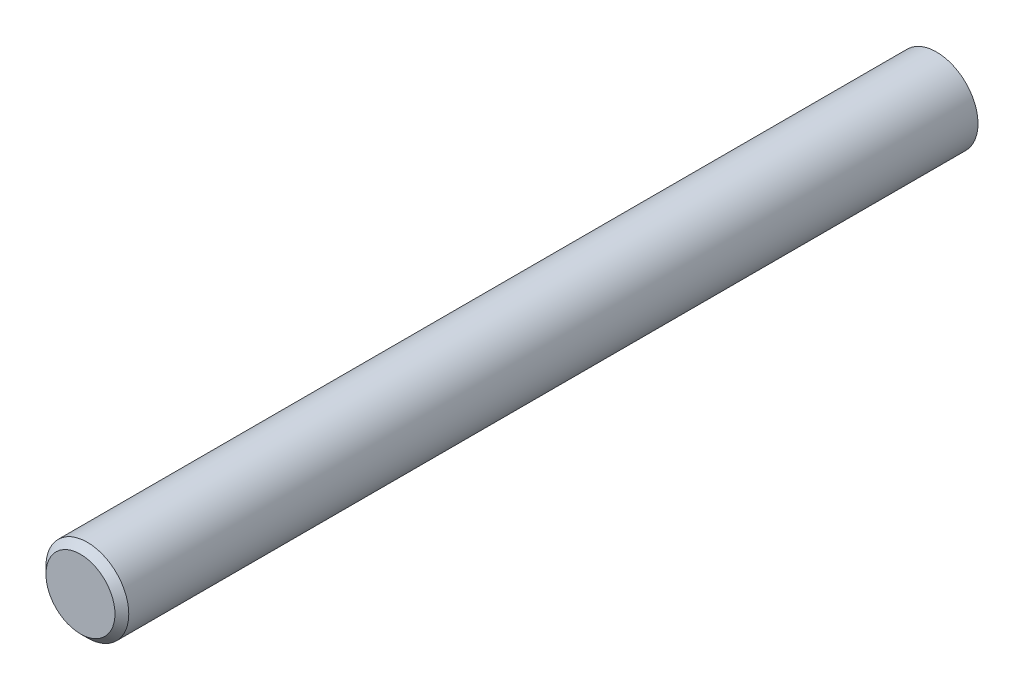
from build123d import *

# Parameters (mm, degrees)
ESQUISSE1_R        = 6
BOSS_EXTRU_1_DEPTH = 124
CHANFREIN1_SIZE    = 1


with BuildPart() as part:
    # Esquisse1 → Boss.-Extru.1 (new body)
    with BuildSketch(Plane.XY):
        Circle(ESQUISSE1_R)
    extrude(amount=BOSS_EXTRU_1_DEPTH)

    # Chanfrein1
    chanfrein1_edges = [part.edges().sort_by_distance(p)[0] for p in [
        (-6, 0, 124),
    ]]
    chamfer(chanfrein1_edges, length=CHANFREIN1_SIZE)


solid = part.part
